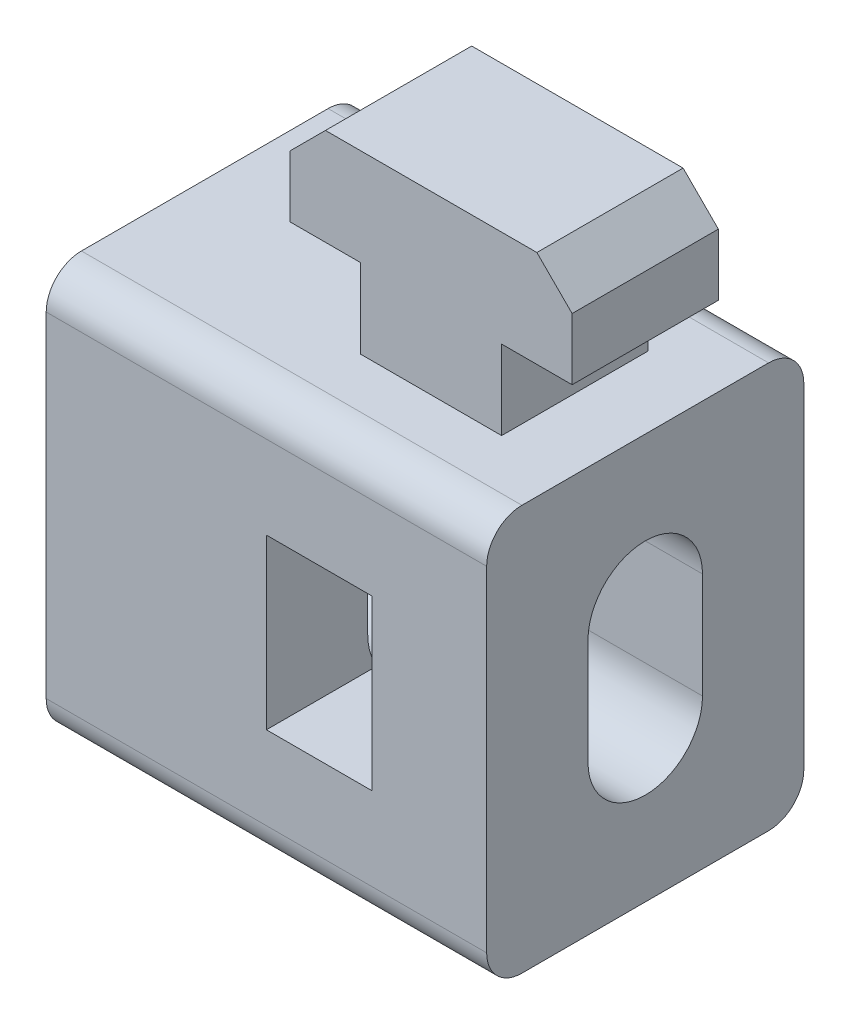
from build123d import *

# Parameters (mm, degrees)
EXTRUDE_1_DEPTH     = 9
CUT_EXTRUDE_1_REACH = 44.367
SKETCH_3_W          = 19.10949688
SKETCH_3_H          = 7.850581447
SKETCH_3_W_2        = 21.646823843
SKETCH_3_H_2        = 9.928676536
CUT_EXTRUDE_2_DEPTH = 43.367440329
SKETCH_5_W          = 6
SKETCH_5_H          = 9.57
CUT_EXTRUDE_3_DEPTH = 10
FILLET_1_R          = 2


with BuildPart() as part:
    # 草图1 → 凸台-拉伸1 (new, symmetric)
    with BuildSketch(Plane.XY):
        Polygon((-14, 33), (-2, 33), (0, 31), (0, 27.5), (-4, 27.5), (-4, 23), (0, 23), (0, 0), (-25, 0), (-25, 23), (-12, 23), (-12, 27.5), (-16, 27.5), (-16, 31), align=None)
    extrude(amount=EXTRUDE_1_DEPTH, both=True)

    # 切除-拉伸1: up to this face of the body (flat: up to its plane)
    cut_extrude_1_end = Plane(part.part.faces().sort_by_distance((-18.5, 23, 0))[0])
    # 草图3 → 切除-拉伸1 (cut, up to the picked face)
    with BuildSketch(Plane(origin=(0, 33, 0), x_dir=(1, 0, 0), z_dir=(0, 1, 0)), mode=Mode.PRIVATE) as cut_extrude_1_sk1:
        with Locations((-9.55474844, 8.075290724)):
            Rectangle(SKETCH_3_W, SKETCH_3_H)
    cut_extrude_1_tool1 = split(extrude(cut_extrude_1_sk1.sketch, amount=-CUT_EXTRUDE_1_REACH, mode=Mode.PRIVATE), bisect_by=cut_extrude_1_end, keep=Keep.BOTH, mode=Mode.PRIVATE)
    # 草图3 → 切除-拉伸1 (cut, up to the picked face)
    with BuildSketch(Plane(origin=(0, 33, 0), x_dir=(1, 0, 0), z_dir=(0, 1, 0)), mode=Mode.PRIVATE) as cut_extrude_1_sk2:
        with Locations((-8.286084959, -9.114338268)):
            Rectangle(SKETCH_3_W_2, SKETCH_3_H_2)
    cut_extrude_1_tool2 = split(extrude(cut_extrude_1_sk2.sketch, amount=-CUT_EXTRUDE_1_REACH, mode=Mode.PRIVATE), bisect_by=cut_extrude_1_end, keep=Keep.BOTH, mode=Mode.PRIVATE)
    add(cut_extrude_1_tool1.solids().sort_by(Axis((-9.554748, 33, -8.075291), (0, -1, 0)))[0], mode=Mode.SUBTRACT)
    add(cut_extrude_1_tool2.solids().sort_by(Axis((-8.286085, 33, 9.114338), (0, -1, 0)))[0], mode=Mode.SUBTRACT)

    # 草图4 → 切除-拉伸2 (cut, through all)
    with BuildSketch(Plane(origin=(0, 0, 0), x_dir=(0, 0, -1), z_dir=(1, 0, 0))):
        with BuildLine():
            Line((-3.25, 8.5), (-3.25, 14.5))
            ThreePointArc((-3.25, 14.5), (0, 17.75), (3.25, 14.5))
            Line((3.25, 14.5), (3.25, 8.5))
            ThreePointArc((3.25, 8.5), (0, 5.25), (-3.25, 8.5))
        make_face()
    extrude(amount=-CUT_EXTRUDE_2_DEPTH, mode=Mode.SUBTRACT)

    # 草图5 → 切除-拉伸3 (cut)
    with BuildSketch(Plane.XY.offset(9)):
        with Locations((-9.5, 11.5)):
            Rectangle(SKETCH_5_W, SKETCH_5_H)
    extrude(amount=-CUT_EXTRUDE_3_DEPTH, mode=Mode.SUBTRACT)

    # 圆角1
    fillet_1_edges = [part.edges().sort_by_distance(p)[0] for p in [
        (-12.5, 23, -9),
        (-12.5, 0, -9),
        (-12.5, 23, 9),
        (-12.5, 0, 9),
    ]]
    fillet(fillet_1_edges, radius=FILLET_1_R)


solid = part.part
